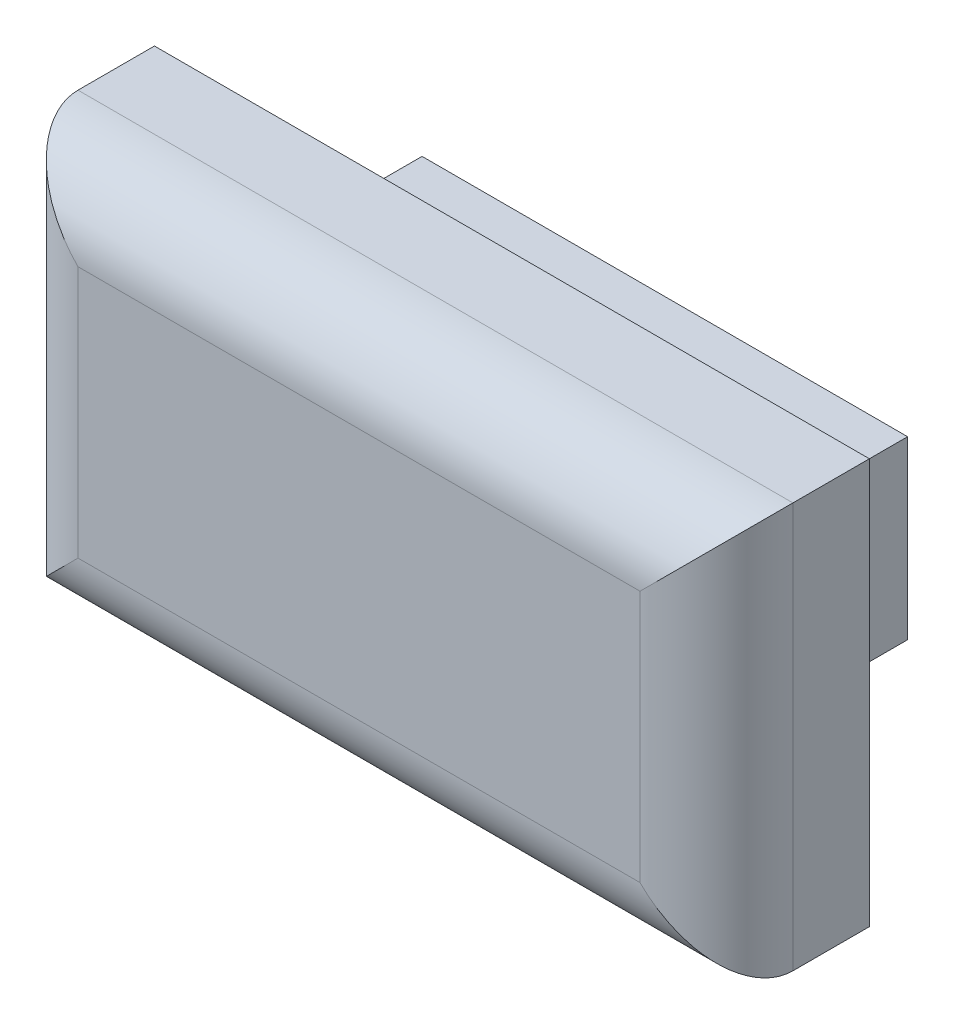
from build123d import *

# Parameters (mm, degrees)
SKETCH2_W           = 6.35
SKETCH2_H           = 2.3
BOSS_EXTRUDE1_DEPTH = 2
SKETCH4_W           = 9.35
SKETCH4_H           = 5.3
BOSS_EXTRUDE3_DEPTH = 2
FILLET1_R           = 1


with BuildPart() as part:
    # Sketch2 → Boss-Extrude1 (new body)
    with BuildSketch(Plane.XY):
        with Locations((-2.304595016, -0.87305296)):
            Rectangle(SKETCH2_W, SKETCH2_H)
    extrude(amount=BOSS_EXTRUDE1_DEPTH)

    # Sketch4 → Boss-Extrude3 (add)
    with BuildSketch(Plane.XY.offset(2)):
        with Locations((-2.304595016, -0.87305296)):
            Rectangle(SKETCH4_W, SKETCH4_H)
    extrude(amount=BOSS_EXTRUDE3_DEPTH)

    # Fillet1
    fillet1_edges = [part.edges().sort_by_distance(p)[0] for p in [
        (2.370404984, -0.87305296, 4),
        (-2.304595016, 1.77694704, 4),
        (-6.979595016, -0.87305296, 4),
        (-2.304595016, -3.52305296, 4),
    ]]
    fillet(fillet1_edges, radius=FILLET1_R)


solid = part.part
